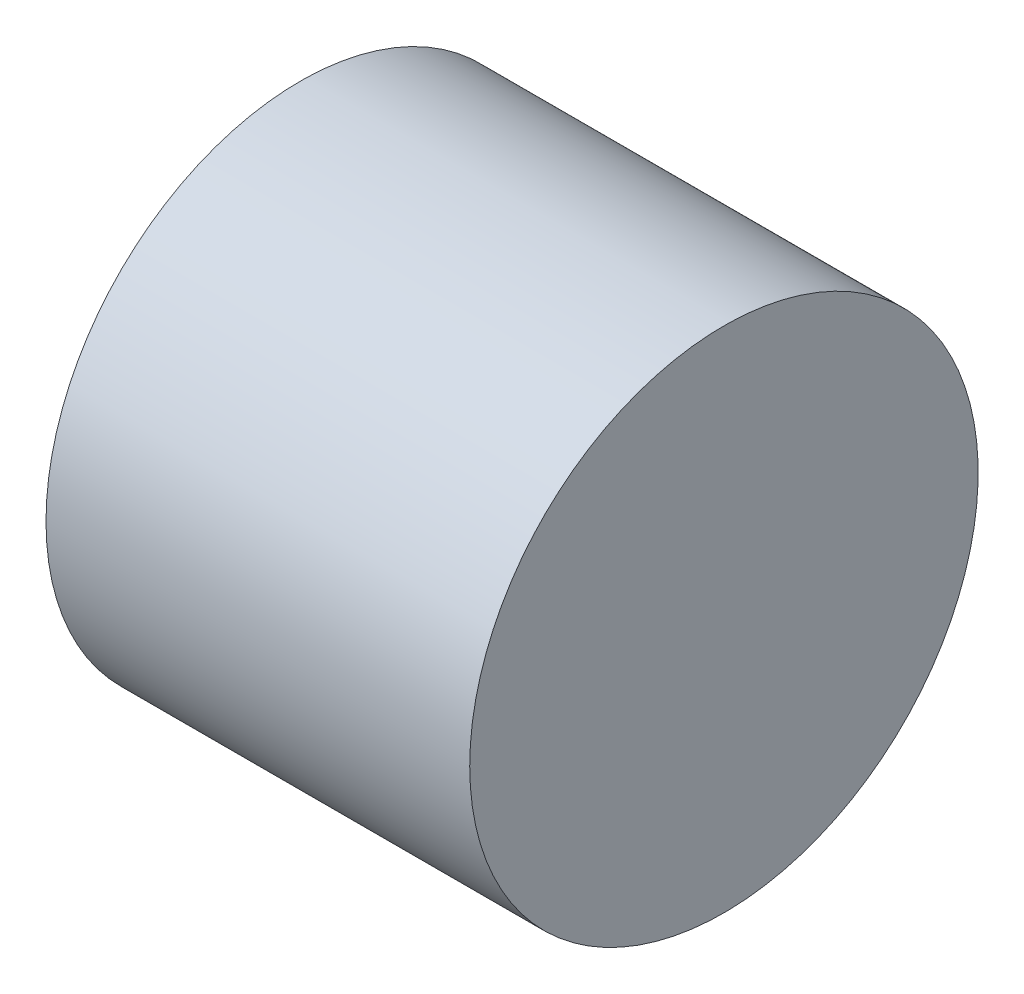
from build123d import *

# Parameters (mm, degrees)
AXIAL_BLANK_PROFILE_W = 10
AXIAL_BLANK_PROFILE_H = 6


with BuildPart() as part:
    # Axial blank profile → Native revolved blank (revolve)
    with BuildSketch(Plane.XY, mode=Mode.PRIVATE) as native_revolved_blank_sk:
        with Locations((-12, 3)):
            Rectangle(AXIAL_BLANK_PROFILE_W, AXIAL_BLANK_PROFILE_H)
    revolve(native_revolved_blank_sk.sketch.rotate(Axis((-60, 0, 0), (1, 0, 0)), 90), axis=Axis((-60, 0, 0), (1, 0, 0)))


solid = part.part
